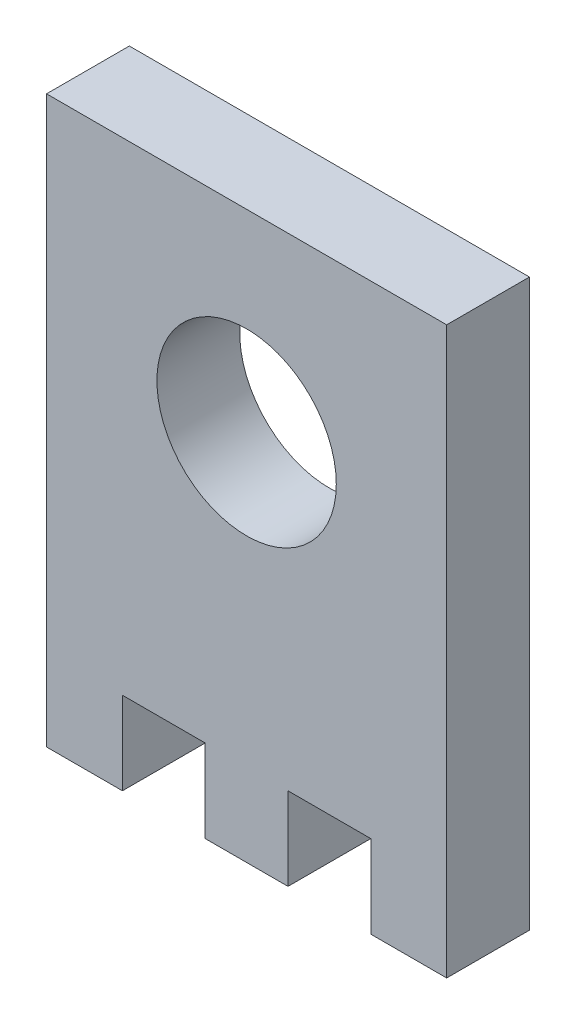
from build123d import *

# Parameters (mm, degrees)
SKETCH1_R           = 3.25
BOSS_EXTRUDE1_DEPTH = 3


with BuildPart() as part:
    # Sketch1 → Boss-Extrude1 (new body)
    with BuildSketch(Plane.XY):
        Polygon((4.245252181, 5.778256787), (4.245252181, 26.278256787), (18.745252181, 26.278256787), (18.745252181, 5.969156991), (18.745252181, 5.778256787), (15.995252181, 5.778256787), (15.995252181, 8.778256787), (12.995252181, 8.778256787), (12.995252181, 5.778256787), (9.995252181, 5.778256787), (9.995252181, 8.778256787), (6.995252181, 8.778256787), (6.995252181, 5.778256787), align=None)
        with Locations((11.495252181, 19.278256787)):
            Circle(SKETCH1_R, mode=Mode.SUBTRACT)
    extrude(amount=BOSS_EXTRUDE1_DEPTH)


solid = part.part
